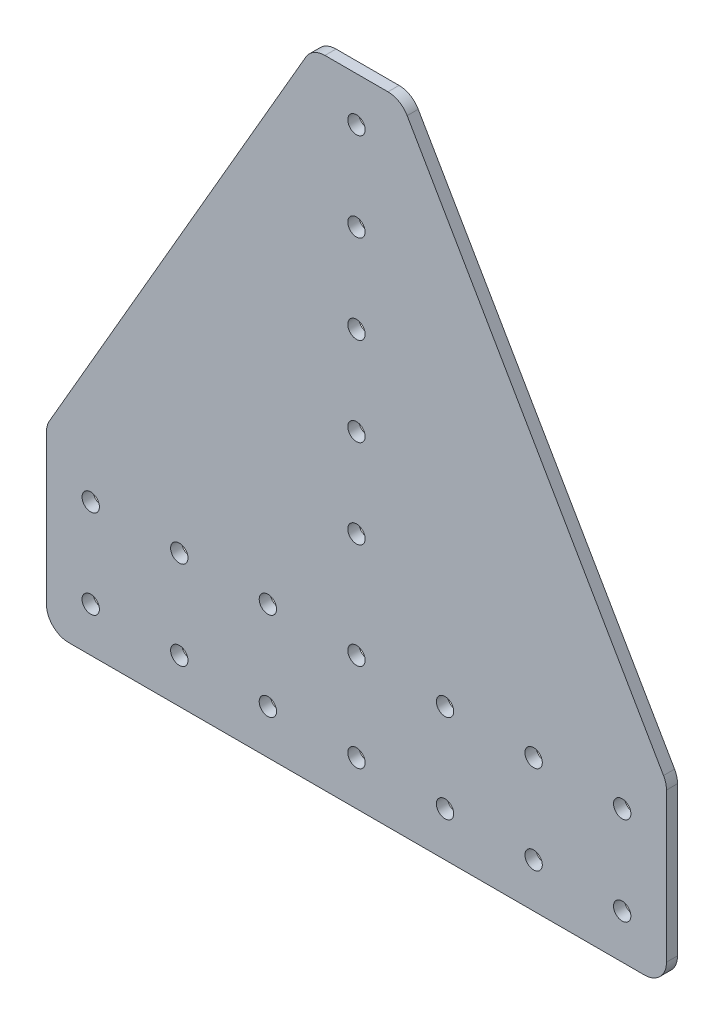
from build123d import *

# Parameters (mm, degrees)
BOSS_EXTRUDE1_DEPTH = 3.175
SKETCH2_R           = 2.4892
CUT_EXTRUDE1_DEPTH  = 255.856797106
FILLET1_R           = 6.35


with BuildPart() as part:
    # Sketch1 → Boss-Extrude1 (new body)
    with BuildSketch(Plane.XY):
        Polygon((0, 0), (0, 50.8), (76.2, 182.5625), (101.6, 182.5625), (177.8, 50.8), (177.8, 0), align=None)
    extrude(amount=-BOSS_EXTRUDE1_DEPTH)

    # Sketch2 → Cut-Extrude1 (cut, through all)
    with BuildSketch(Plane.XY):
        with Locations((12.7, 12.7)):
            Circle(SKETCH2_R)
        with Locations((38.1, 12.7)):
            Circle(SKETCH2_R)
        with Locations((63.5, 12.7)):
            Circle(SKETCH2_R)
        with Locations((88.9, 12.7)):
            Circle(SKETCH2_R)
        with Locations((114.3, 12.7)):
            Circle(SKETCH2_R)
        with Locations((139.7, 12.7)):
            Circle(SKETCH2_R)
        with Locations((165.1, 12.7)):
            Circle(SKETCH2_R)
        with Locations((38.1, 38.1)):
            Circle(SKETCH2_R)
        with Locations((63.5, 38.1)):
            Circle(SKETCH2_R)
        with Locations((88.9, 38.1)):
            Circle(SKETCH2_R)
        with Locations((114.3, 38.1)):
            Circle(SKETCH2_R)
        with Locations((139.7, 38.1)):
            Circle(SKETCH2_R)
        with Locations((165.1, 38.1)):
            Circle(SKETCH2_R)
        with Locations((12.7, 38.1)):
            Circle(SKETCH2_R)
        with Locations((88.9, 169.8625)):
            Circle(SKETCH2_R)
        with Locations((88.9, 144.4625)):
            Circle(SKETCH2_R)
        with Locations((88.9, 119.0625)):
            Circle(SKETCH2_R)
        with Locations((88.9, 93.6625)):
            Circle(SKETCH2_R)
        with Locations((88.9, 68.2625)):
            Circle(SKETCH2_R)
    extrude(amount=-CUT_EXTRUDE1_DEPTH, mode=Mode.SUBTRACT)

    # Fillet1
    fillet1_edges = [part.edges().sort_by_distance(p)[0] for p in [
        (0, 0, -1.5875),
        (177.8, 0, -1.5875),
        (177.8, 50.8, -1.5875),
        (101.6, 182.5625, -1.5875),
        (76.2, 182.5625, -1.5875),
        (0, 50.8, -1.5875),
    ]]
    fillet(fillet1_edges, radius=FILLET1_R)


solid = part.part
